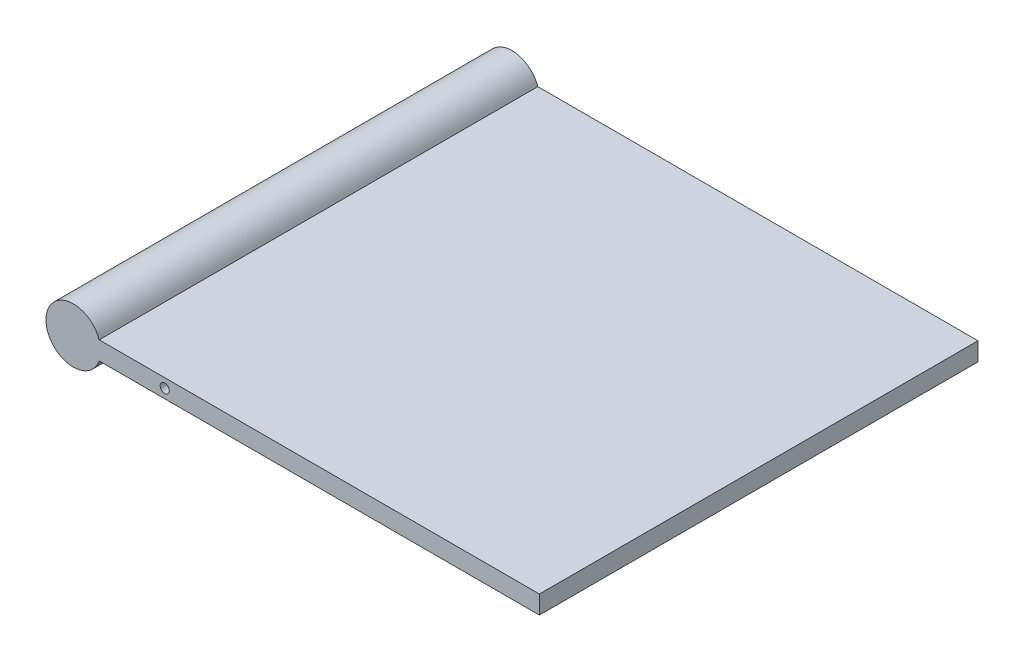
from build123d import *

# Parameters (mm, degrees)
EXTRUDE1_DEPTH     = 152.4
SKETCH2_R          = 3.175
CUT_EXTRUDE1_DEPTH = 446.134547075


with BuildPart() as part:
    # Sketch1 → Extrude1 (new, symmetric)
    with BuildSketch(Plane.XY):
        with BuildLine():
            Line((323.85, 6.35), (323.85, -6.35))
            Line((323.85, -6.35), (17.960512242, -6.35))
            ThreePointArc((17.960512242, -6.35), (-19.05, 0), (17.960512242, 6.35))
            Line((17.960512242, 6.35), (323.85, 6.35))
        make_face()
    extrude(amount=EXTRUDE1_DEPTH, both=True)

    # Sketch2 → Cut-Extrude1 (cut, through all)
    with BuildSketch(Plane.XY.offset(152.4)):
        with Locations((63.5, 0)):
            Circle(SKETCH2_R)
    extrude(amount=-CUT_EXTRUDE1_DEPTH, mode=Mode.SUBTRACT)


solid = part.part
